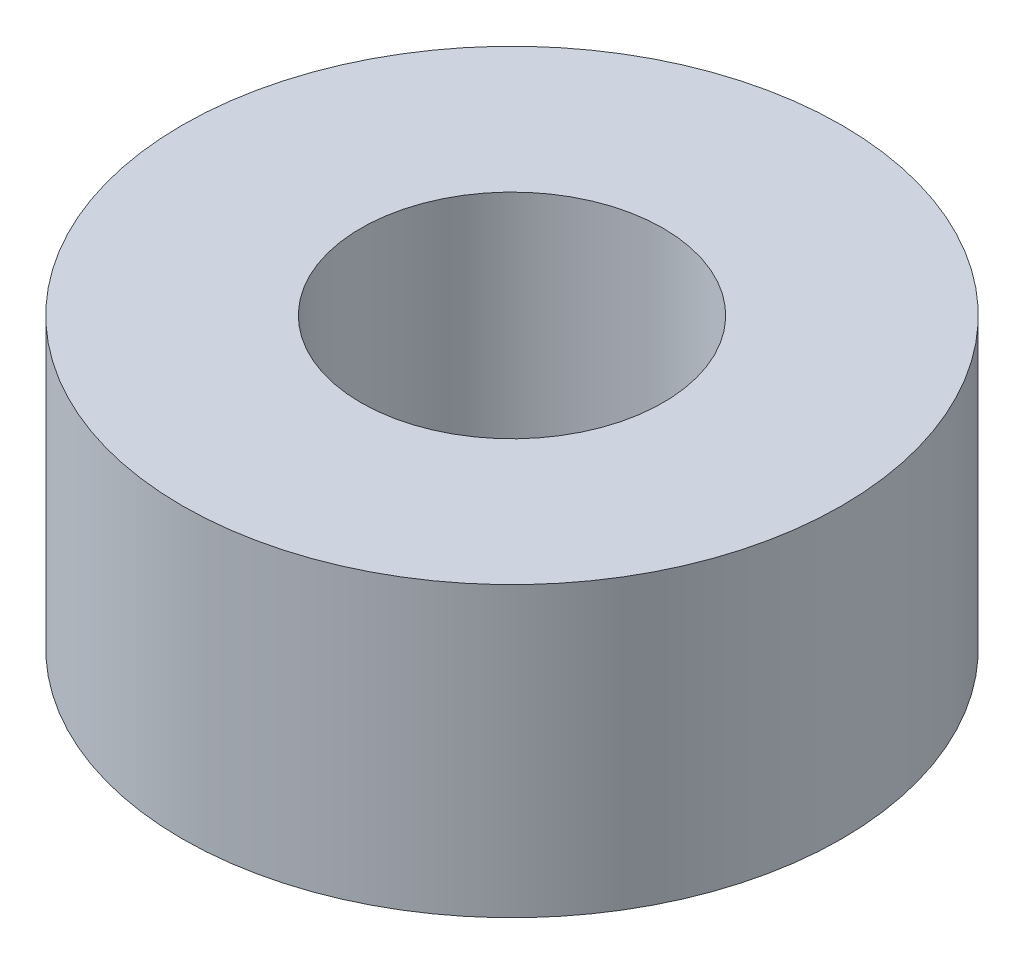
from build123d import *

# Parameters (mm, degrees)
SKETCH1_R           = 12
SKETCH1_R_2         = 5.5
BOSS_EXTRUDE2_DEPTH = 10.5


with BuildPart() as part:
    # Sketch1 → Boss-Extrude2 (new body)
    with BuildSketch(Plane(origin=(0, 0, 0), x_dir=(1, 0, 0), z_dir=(0, 1, 0))):
        with Locations(Location((0, 0, 0), (0, 0, 90))):
            Circle(SKETCH1_R)
        with Locations(Location((0, 0, 0), (0, 0, 90))):
            Circle(SKETCH1_R_2, mode=Mode.SUBTRACT)
    extrude(amount=BOSS_EXTRUDE2_DEPTH)


solid = part.part
